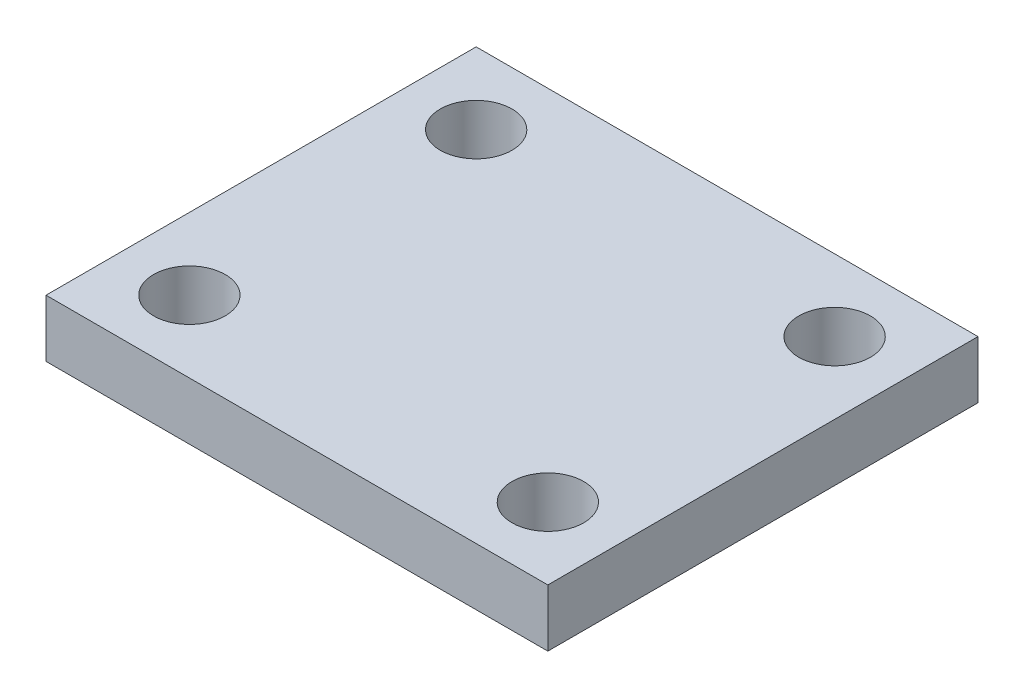
from build123d import *

# Parameters (mm, degrees)
SKETCH1_W           = 35
SKETCH1_H           = 30
SKETCH1_R           = 2.5
BOSS_EXTRUDE1_DEPTH = 4


with BuildPart() as part:
    # Sketch1 → Boss-Extrude1 (new body)
    with BuildSketch(Plane(origin=(0, 0, 0), x_dir=(1, 0, 0), z_dir=(0, 1, 0))):
        with Locations((17.5, 15)):
            Rectangle(SKETCH1_W, SKETCH1_H)
        with Locations(Location((5, 25, 0), (0, 0, 270))):
            Circle(SKETCH1_R, mode=Mode.SUBTRACT)
        with Locations(Location((30, 25, 0), (0, 0, 270))):
            Circle(SKETCH1_R, mode=Mode.SUBTRACT)
        with Locations(Location((5, 5, 0), (0, 0, 270))):
            Circle(SKETCH1_R, mode=Mode.SUBTRACT)
        with Locations(Location((30, 5, 0), (0, 0, 270))):
            Circle(SKETCH1_R, mode=Mode.SUBTRACT)
    extrude(amount=BOSS_EXTRUDE1_DEPTH)


solid = part.part
